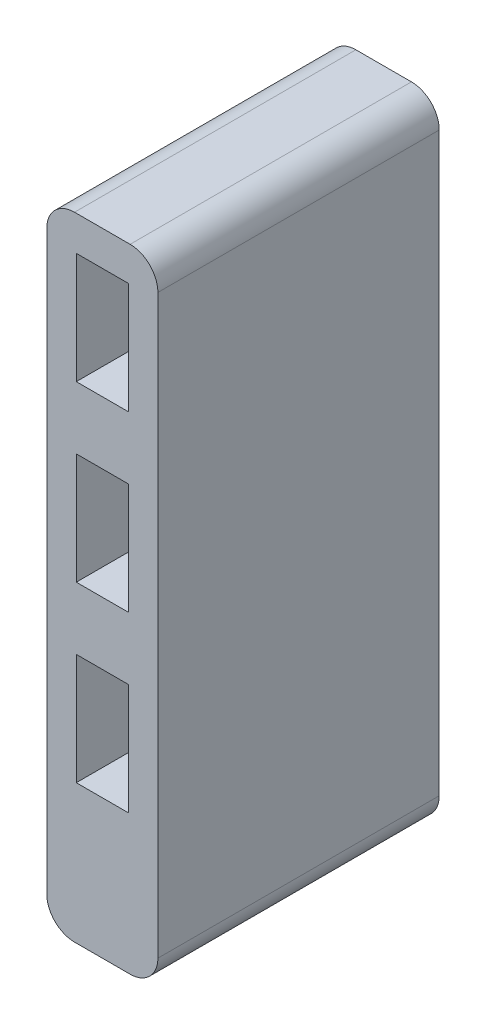
from build123d import *

# Parameters (mm, degrees)
BOSS_EXTRUDE1_DEPTH = 40.5
SKETCH2_W           = 7.5
SKETCH2_H           = 16
CUT_EXTRUDE1_DEPTH  = 12.5


with BuildPart() as part:
    # Sketch1 → Boss-Extrude1 (new body)
    with BuildSketch(Plane.XY):
        with BuildLine():
            Line((-4, -45.5), (4, -45.5))
            ThreePointArc((4, -45.5), (6.828427125, -44.328427125), (8, -41.5))
            Line((8, -41.5), (8, 41.5))
            ThreePointArc((8, 41.5), (6.828427125, 44.328427125), (4, 45.5))
            Line((4, 45.5), (-4, 45.5))
            ThreePointArc((-4, 45.5), (-6.828427125, 44.328427125), (-8, 41.5))
            Line((-8, 41.5), (-8, -41.5))
            ThreePointArc((-8, -41.5), (-6.828427125, -44.328427125), (-4, -45.5))
        make_face()
    extrude(amount=BOSS_EXTRUDE1_DEPTH)

    # Sketch2 → Cut-Extrude1 (cut)
    with BuildSketch(Plane.XY.offset(40.5)):
        with Locations((0, 7.5)):
            Rectangle(SKETCH2_W, SKETCH2_H)
        with Locations((0, 32.5)):
            Rectangle(SKETCH2_W, SKETCH2_H)
        with Locations((0, -17.5)):
            Rectangle(SKETCH2_W, SKETCH2_H)
    extrude(amount=-CUT_EXTRUDE1_DEPTH, mode=Mode.SUBTRACT)


solid = part.part
